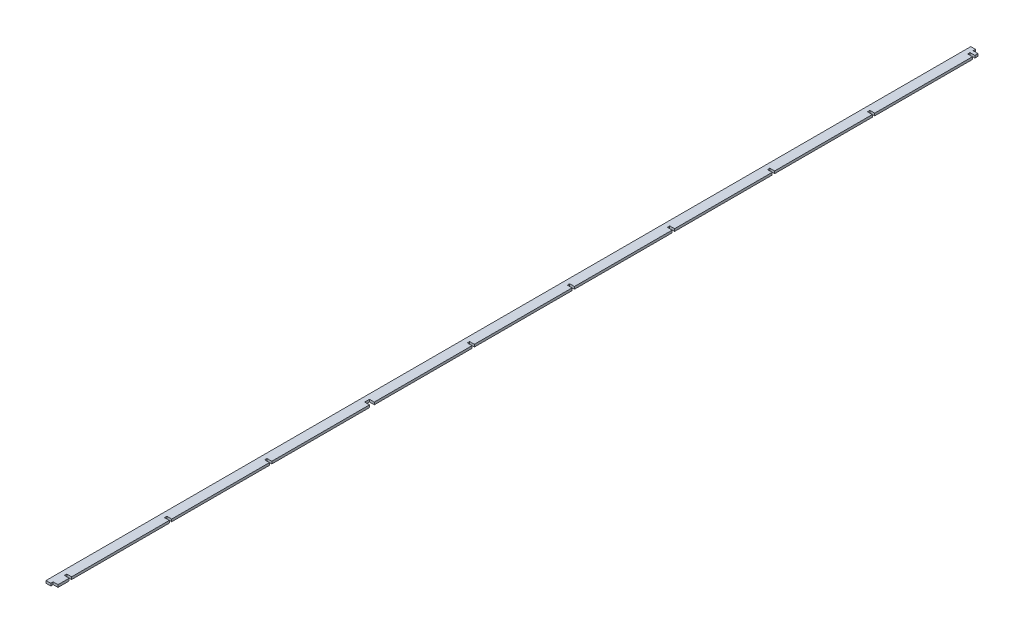
from build123d import *

# Parameters (mm, degrees)
SKETCH_1_W          = 12
SKETCH_1_H          = 3
EXTRUDE_1_DEPTH     = 1155
SKETCH_3_W          = 6
SKETCH_3_H          = 3.01
SKETCH_3_H_2        = 3
CUT_EXTRUDE_1_DEPTH = 1164.115381597


with BuildPart() as part:
    # 草图1 → 凸台-拉伸1 (new body)
    with BuildSketch(Plane.XY):
        with Locations((-131.125456821, -6.801880905)):
            Rectangle(SKETCH_1_W, SKETCH_1_H)
    extrude(amount=EXTRUDE_1_DEPTH)

    # 草图3 → 切除-拉伸1 (cut, through all)
    with BuildSketch(Plane(origin=(0, -5.301880905, 0), x_dir=(1, 0, 0), z_dir=(0, 1, 0))):
        with Locations((-128.125456821, -1.505)):
            Rectangle(SKETCH_3_W, SKETCH_3_H)
        with Locations((-128.125456821, -8.5)):
            Rectangle(SKETCH_3_W, SKETCH_3_H_2)
        with Locations((-128.125456821, -133.5)):
            Rectangle(SKETCH_3_W, SKETCH_3_H_2)
        with Locations((-128.125456821, -258.5)):
            Rectangle(SKETCH_3_W, SKETCH_3_H_2)
        with Locations((-128.125456821, -383.5)):
            Rectangle(SKETCH_3_W, SKETCH_3_H_2)
        with Locations((-128.125456821, -508.5)):
            Rectangle(SKETCH_3_W, SKETCH_3_H_2)
        with Locations((-128.125456821, -633.5)):
            Rectangle(SKETCH_3_W, SKETCH_3_H_2)
        with Locations((-128.125456821, -758.5)):
            Rectangle(SKETCH_3_W, SKETCH_3_H_2)
        with Locations((-128.125456821, -761.5)):
            Rectangle(SKETCH_3_W, SKETCH_3_H_2)
        with Locations((-128.125456821, -886.5)):
            Rectangle(SKETCH_3_W, SKETCH_3_H_2)
        with Locations((-128.125456821, -1011.5)):
            Rectangle(SKETCH_3_W, SKETCH_3_H_2)
        with Locations((-128.125456821, -1136.5)):
            Rectangle(SKETCH_3_W, SKETCH_3_H_2)
        with Locations((-128.125456821, -1153.5)):
            Rectangle(SKETCH_3_W, SKETCH_3_H_2)
    extrude(amount=-CUT_EXTRUDE_1_DEPTH, mode=Mode.SUBTRACT)


solid = part.part
